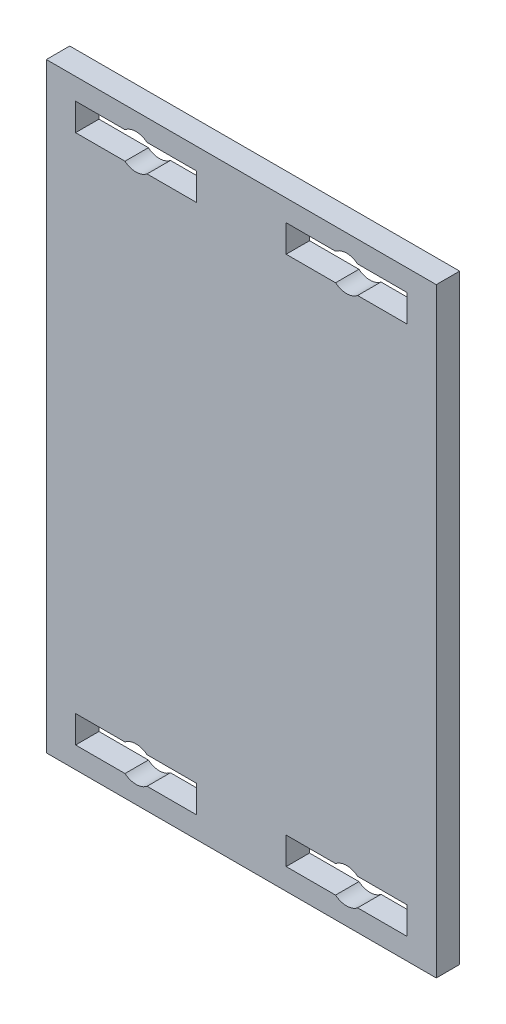
from build123d import *

# Parameters (mm, degrees)
SKETCH_1_W      = 50
SKETCH_1_H      = 77
EXTRUDE_1_DEPTH = 3


with BuildPart() as part:
    # 草图1 → 凸台-拉伸1 (new body)
    with BuildSketch(Plane.XY):
        Rectangle(SKETCH_1_W, SKETCH_1_H)
        with BuildLine():
            Line((-12.085786438, 32.25), (-5.75, 32.25))
            Line((-5.75, 32.25), (-5.75, 35.75))
            Line((-5.75, 35.75), (-12.085786438, 35.75))
            ThreePointArc((-12.085786438, 35.75), (-13.5, 36.25), (-14.914213562, 35.75))
            Line((-14.914213562, 35.75), (-21.25, 35.75))
            Line((-21.25, 35.75), (-21.25, 32.25))
            Line((-21.25, 32.25), (-14.914213562, 32.25))
            ThreePointArc((-14.914213562, 32.25), (-13.5, 31.75), (-12.085786438, 32.25))
        make_face(mode=Mode.SUBTRACT)
        with BuildLine():
            Line((21.25, 35.75), (21.25, 32.25))
            Line((21.25, 32.25), (14.914213562, 32.25))
            ThreePointArc((14.914213562, 32.25), (13.5, 31.75), (12.085786438, 32.25))
            Line((12.085786438, 32.25), (5.75, 32.25))
            Line((5.75, 32.25), (5.75, 35.75))
            Line((5.75, 35.75), (12.085786438, 35.75))
            ThreePointArc((12.085786438, 35.75), (13.5, 36.25), (14.914213562, 35.75))
            Line((14.914213562, 35.75), (21.25, 35.75))
        make_face(mode=Mode.SUBTRACT)
        with BuildLine():
            Line((21.25, -35.75), (14.914213562, -35.75))
            ThreePointArc((14.914213562, -35.75), (13.5, -36.25), (12.085786438, -35.75))
            Line((12.085786438, -35.75), (5.75, -35.75))
            Line((5.75, -35.75), (5.75, -32.25))
            Line((5.75, -32.25), (12.085786438, -32.25))
            ThreePointArc((12.085786438, -32.25), (13.5, -31.75), (14.914213562, -32.25))
            Line((14.914213562, -32.25), (21.25, -32.25))
            Line((21.25, -32.25), (21.25, -35.75))
        make_face(mode=Mode.SUBTRACT)
        with BuildLine():
            Line((-21.25, -35.75), (-21.25, -32.25))
            Line((-21.25, -32.25), (-14.914213562, -32.25))
            ThreePointArc((-14.914213562, -32.25), (-13.5, -31.75), (-12.085786438, -32.25))
            Line((-12.085786438, -32.25), (-5.75, -32.25))
            Line((-5.75, -32.25), (-5.75, -35.75))
            Line((-5.75, -35.75), (-12.085786438, -35.75))
            ThreePointArc((-12.085786438, -35.75), (-13.5, -36.25), (-14.914213562, -35.75))
            Line((-14.914213562, -35.75), (-21.25, -35.75))
        make_face(mode=Mode.SUBTRACT)
    extrude(amount=EXTRUDE_1_DEPTH)


solid = part.part
